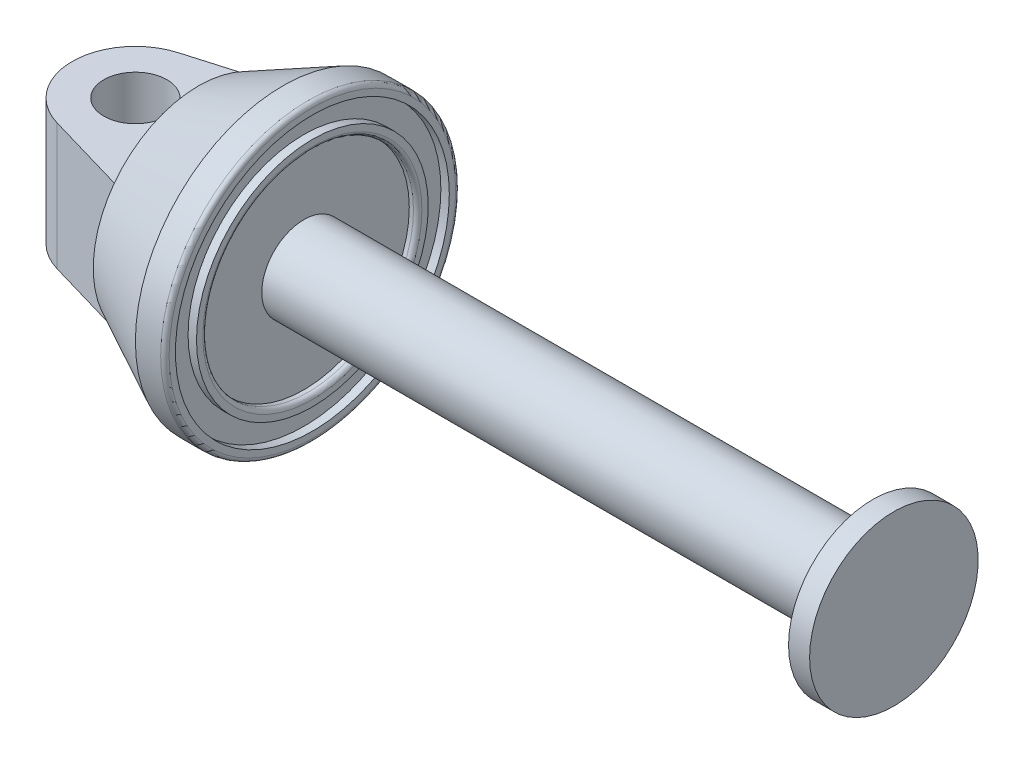
from build123d import *

# Parameters (mm, degrees)
BOSS_EXTRUDE1_START = 1
SKETCH2_R           = 17.5
SKETCH2_R_2         = 16.25
SKETCH2_R_3         = 13.75
SKETCH2_R_4         = 12.5
BOSS_EXTRUDE1_DEPTH = 1
FILLET1_R           = 0.5
SKETCH3_R           = 3.75
BOSS_EXTRUDE2_DEPTH = 7.5


with BuildPart() as part:
    # Sketch1 → Revolve1 (revolve)
    with BuildSketch(Plane(origin=(0, 0, 0), x_dir=(1, 0, 0), z_dir=(0, 1, 0)), mode=Mode.PRIVATE) as revolve1_sk:
        Polygon((-36.25, 17.5), (-33.75, 17.5), (-33.75, 5), (33.75, 5), (33.75, 10), (36.25, 10), (36.25, 0), (-36.25, 0), (-46.25, 0), (-46.25, 12.5), align=None)
    revolve(revolve1_sk.sketch.rotate(Axis((-36.25, 0, 0), (1, 0, 0)), 180), axis=Axis((-36.25, 0, 0), (1, 0, 0)))

    # Sketch2 → Boss-Extrude1 (add)
    # profile 1 of 2: a face of its own
    with BuildSketch(Plane(origin=(-33.75, 0, 0), x_dir=(0, 0, -1), z_dir=(1, 0, 0)).offset(BOSS_EXTRUDE1_START)):
        with Locations(Location((0, 0, 0), (0, 0, 180))):
            Circle(SKETCH2_R)
        Circle(SKETCH2_R_2, mode=Mode.SUBTRACT)
    # profile 2 of 2: a face of its own
    with BuildSketch(Plane(origin=(-33.75, 0, 0), x_dir=(0, 0, -1), z_dir=(1, 0, 0)).offset(BOSS_EXTRUDE1_START)):
        with Locations(Location((0, 0, 0), (0, 0, 180))):
            Circle(SKETCH2_R_3)
        Circle(SKETCH2_R_4, mode=Mode.SUBTRACT)
    extrude(amount=-BOSS_EXTRUDE1_DEPTH)

    # Fillet1
    fillet1_edges = [part.edges().sort_by_distance(p)[0] for p in [
        (-32.75, 0, -17.5),
        (-32.75, 0, 12.5),
    ]]
    fillet(fillet1_edges, radius=FILLET1_R)

    # Sketch3 → Boss-Extrude2 (add, symmetric)
    with BuildSketch(Plane(origin=(0, 0, 0), x_dir=(1, 0, 0), z_dir=(0, 1, 0))):
        with BuildLine():
            Line((-46.25, 10), (-46.25, -10))
            Line((-46.25, -10), (-55.85, -7.2))
            ThreePointArc((-55.85, -7.2), (-61.25, 0), (-55.85, 7.2))
            Line((-55.85, 7.2), (-46.25, 10))
        make_face()
        with Locations(Location((-53.75, 0, 0), (0, 0, 270))):
            Circle(SKETCH3_R, mode=Mode.SUBTRACT)
    extrude(amount=BOSS_EXTRUDE2_DEPTH, both=True)


solid = part.part
